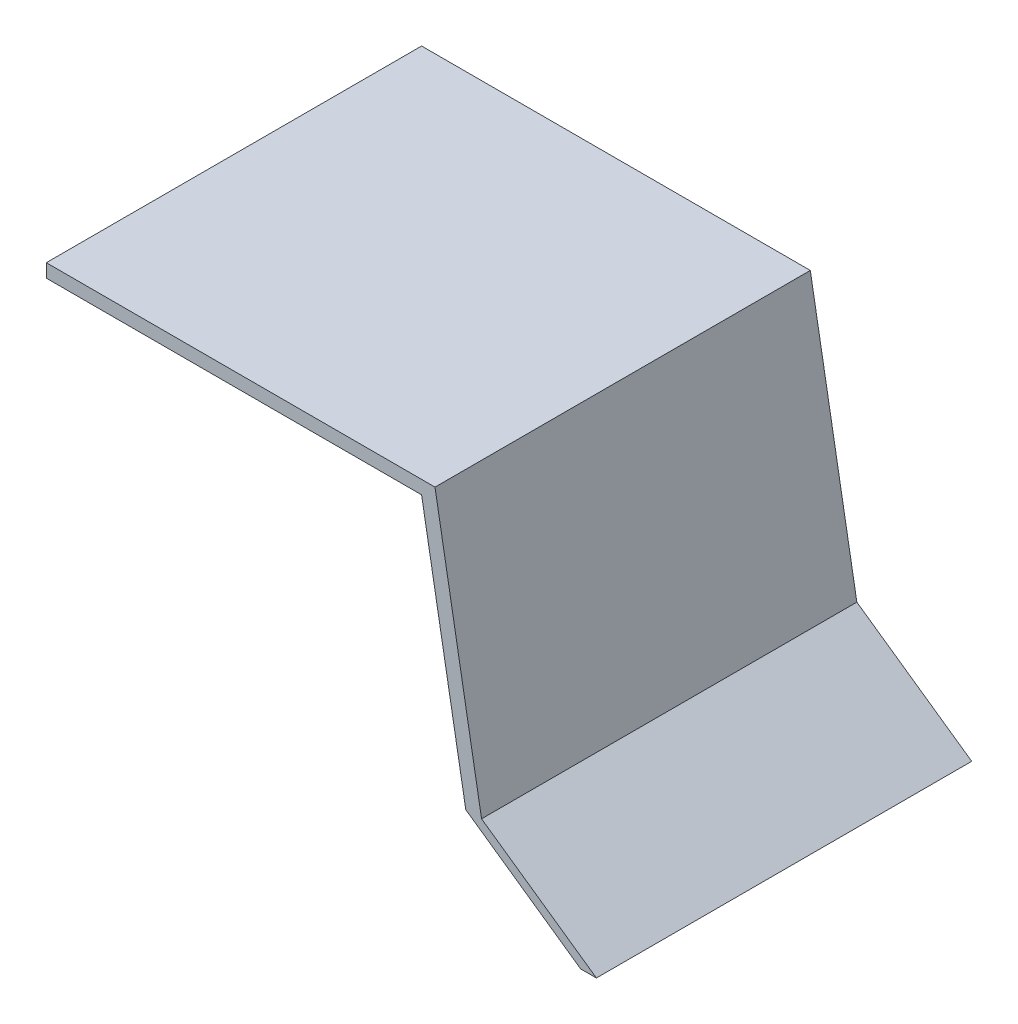
from build123d import *

# Parameters (mm, degrees)
SKETCH1_W           = 355.6
SKETCH1_H           = 355.6
BOSS_EXTRUDE1_DEPTH = 12.7
BOSS_EXTRUDE2_DEPTH = 12.7
BOSS_EXTRUDE4_DEPTH = 355.6


with BuildPart() as part:
    # Sketch1 → Boss-Extrude1 (new body)
    with BuildSketch(Plane(origin=(0, 0, 0), x_dir=(1, 0, 0), z_dir=(0, 1, 0))):
        with Locations((177.8, 177.8)):
            Rectangle(SKETCH1_W, SKETCH1_H)
    extrude(amount=BOSS_EXTRUDE1_DEPTH)

    # Sketch3 → Boss-Extrude2 (add, symmetric)
    with BuildSketch(Plane(origin=(177.8, 0, 0), x_dir=(0, 0, -1), z_dir=(1, 0, 0))):
        with BuildLine():
            Line((158.75, 0), (158.75, -15))
            ThreePointArc((158.75, -15), (177.8, -34.05), (196.85, -15))
            Line((196.85, -15), (196.85, 0))
            Line((196.85, 0), (184.15, 0))
            Line((184.15, 0), (184.15, -15))
            ThreePointArc((184.15, -15), (177.8, -21.35), (171.45, -15))
            Line((171.45, -15), (171.45, 0))
            Line((171.45, 0), (158.75, 0))
        make_face()
    extrude(amount=BOSS_EXTRUDE2_DEPTH, both=True)

    # Sketch6 → Boss-Extrude4 (add)
    with BuildSketch(Plane.XY):
        Polygon((368.3, 12.7), (412.406637127, -237.441169265), (521.231515241, -313.641169265), (506.292162586, -313.641169265), (397.467284472, -237.441169265), (355.6, 0), (355.6, 12.7), align=None)
    extrude(amount=-BOSS_EXTRUDE4_DEPTH)


solid = part.part
